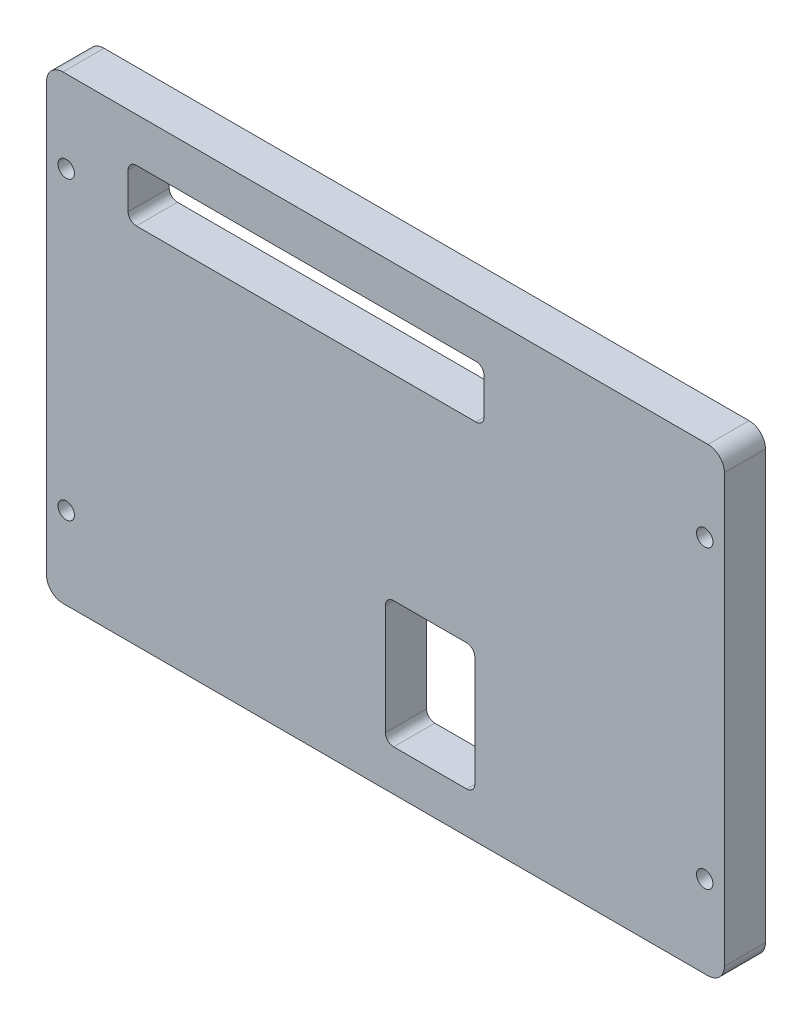
from build123d import *

# Parameters (mm, degrees)
BOSS_EXTRUDE1_DEPTH = 6.35
SKETCH2_R           = 1.27
CUT_EXTRUDE1_DEPTH  = 64.634002359


with BuildPart() as part:
    # Sketch1 → Boss-Extrude1 (new body)
    with BuildSketch(Plane.XY):
        with BuildLine():
            Line((52.3875, -33.02), (52.3875, 33.02))
            ThreePointArc((52.3875, 33.02), (51.643551224, 34.816051224), (49.8475, 35.56))
            Line((49.8475, 35.56), (-49.8475, 35.56))
            ThreePointArc((-49.8475, 35.56), (-51.643551224, 34.816051224), (-52.3875, 33.02))
            Line((-52.3875, 33.02), (-52.3875, -33.02))
            ThreePointArc((-52.3875, -33.02), (-51.643551224, -34.816051224), (-49.8475, -35.56))
            Line((-49.8475, -35.56), (49.8475, -35.56))
            ThreePointArc((49.8475, -35.56), (51.643551224, -34.816051224), (52.3875, -33.02))
        make_face()
        with BuildLine():
            Line((-38.502324621, 28.736218676), (13.971672014, 28.736218676))
            ThreePointArc((13.971672014, 28.736218676), (14.869697627, 28.364244288), (15.241672014, 27.466218676))
            Line((15.241672014, 27.466218676), (15.241672014, 21.89465856))
            ThreePointArc((15.241672014, 21.89465856), (14.869697627, 20.996632948), (13.971672014, 20.62465856))
            Line((13.971672014, 20.62465856), (-38.502324621, 20.62465856))
            ThreePointArc((-38.502324621, 20.62465856), (-39.400350233, 20.996632948), (-39.772324621, 21.89465856))
            Line((-39.772324621, 21.89465856), (-39.772324621, 27.466218676))
            ThreePointArc((-39.772324621, 27.466218676), (-39.400350233, 28.364244288), (-38.502324621, 28.736218676))
        make_face(mode=Mode.SUBTRACT)
        with BuildLine():
            Line((1.27, -9.646243467), (12.539518383, -9.646243467))
            ThreePointArc((12.539518383, -9.646243467), (13.437543995, -10.018217855), (13.809518383, -10.916243467))
            Line((13.809518383, -10.916243467), (13.809518383, -27.94))
            ThreePointArc((13.809518383, -27.94), (13.437543995, -28.838025612), (12.539518383, -29.21))
            Line((12.539518383, -29.21), (1.27, -29.21))
            ThreePointArc((1.27, -29.21), (0.371974388, -28.838025612), (0, -27.94))
            Line((0, -27.94), (0, -10.916243467))
            ThreePointArc((0, -10.916243467), (0.371974388, -10.018217855), (1.27, -9.646243467))
        make_face(mode=Mode.SUBTRACT)
    extrude(amount=BOSS_EXTRUDE1_DEPTH)

    # Sketch2 → Cut-Extrude1 (cut, through all)
    with BuildSketch(Plane.XY.offset(6.35)):
        with Locations((-49.3395, -22.86)):
            Circle(SKETCH2_R)
        with Locations((-49.3395, 22.86)):
            Circle(SKETCH2_R)
        with Locations((49.3395, 22.86)):
            Circle(SKETCH2_R)
        with Locations((49.3395, -22.86)):
            Circle(SKETCH2_R)
    extrude(amount=-CUT_EXTRUDE1_DEPTH, mode=Mode.SUBTRACT)


solid = part.part
